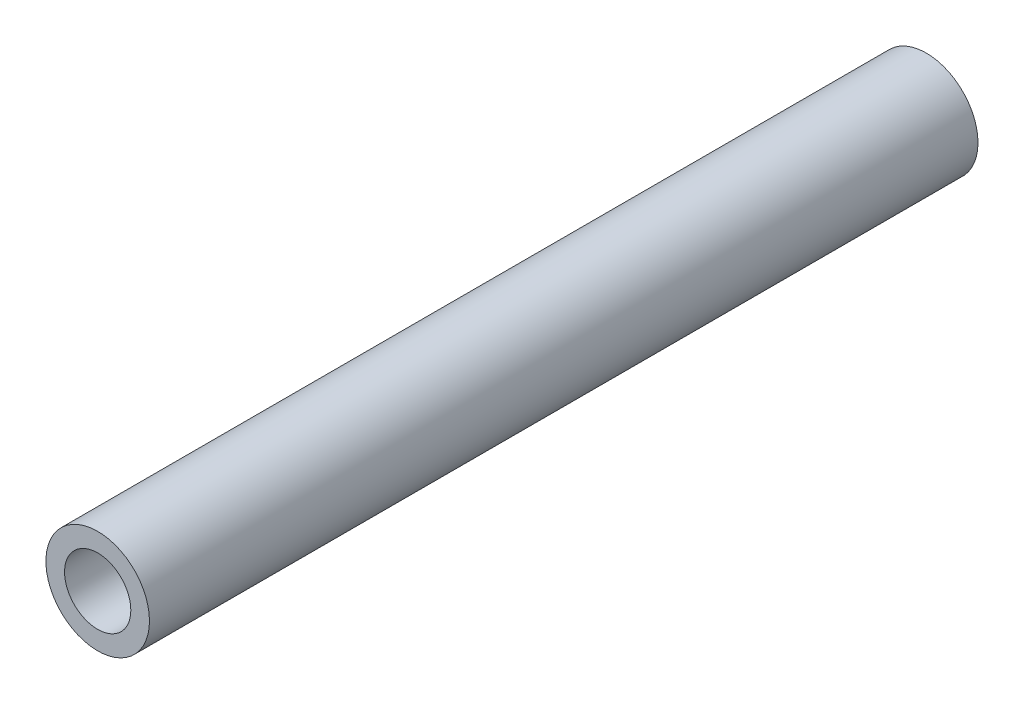
from build123d import *

# Parameters (mm, degrees)
SKETCH_1_R      = 2.5
SKETCH_1_R_2    = 1.6
EXTRUDE_1_DEPTH = 40


with BuildPart() as part:
    # 草图1 → 凸台-拉伸1 (new body)
    with BuildSketch(Plane.XY):
        Circle(SKETCH_1_R)
        Circle(SKETCH_1_R_2, mode=Mode.SUBTRACT)
    extrude(amount=EXTRUDE_1_DEPTH)


solid = part.part
